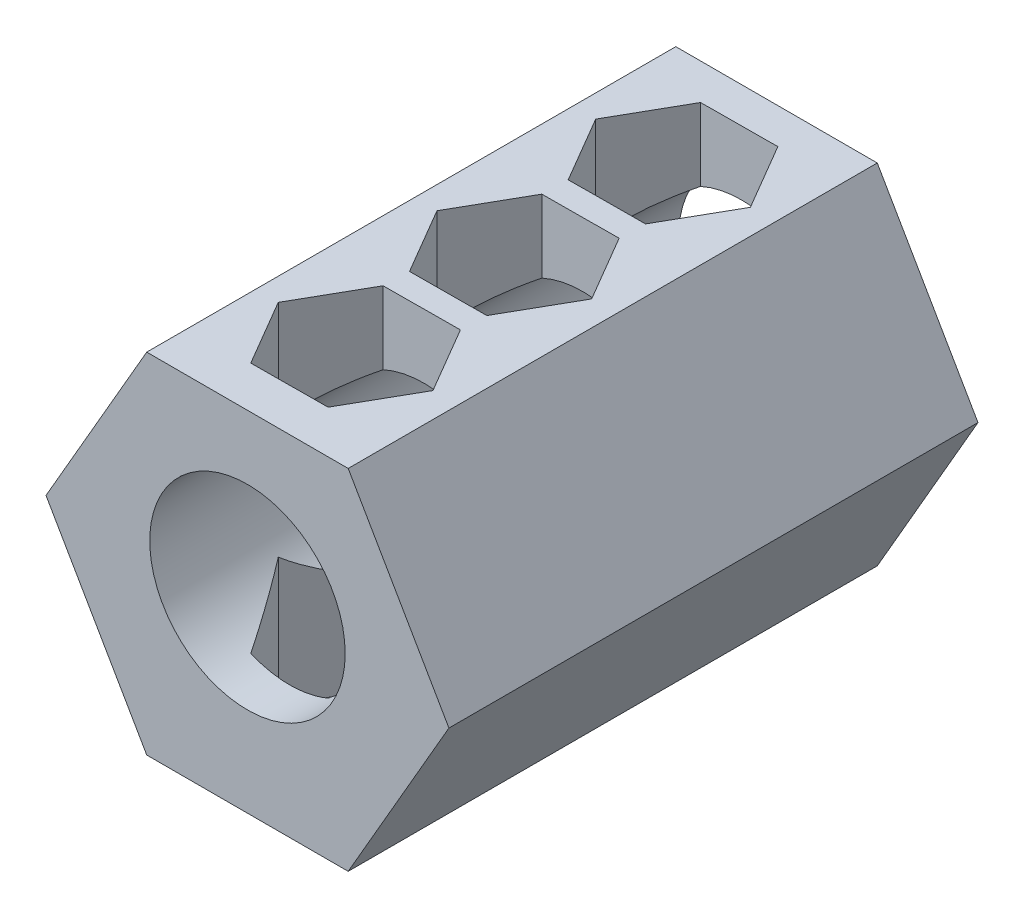
from build123d import *

# Parameters (mm, degrees)
EXTRUDE_1_DEPTH     = 100
SKETCH_2_R          = 18.469515879
CUT_EXTRUDE_1_DEPTH = 100
CUT_EXTRUDE_6_DEPTH = 126.697486666


with BuildPart() as part:
    # 草图1 → 凸台-拉伸1 (new body)
    with BuildSketch(Plane.XY):
        Polygon((38.078399894, 0), (19.039199947, 32.976861644), (-19.039199947, 32.976861644), (-38.078399894, 0), (-19.039199947, -32.976861644), (19.039199947, -32.976861644), align=None)
    extrude(amount=EXTRUDE_1_DEPTH)

    # 草图2 → 切除-拉伸1 (cut)
    with BuildSketch(Plane.XY.offset(100)):
        with Locations((0, 2.389391374)):
            Circle(SKETCH_2_R)
    extrude(amount=-CUT_EXTRUDE_1_DEPTH, mode=Mode.SUBTRACT)

    # 草图7 → 切除-拉伸6 (cut, through all)
    with BuildSketch(Plane(origin=(0, 32.976861644, 0), x_dir=(1, 0, 0), z_dir=(0, 1, 0))):
        Polygon((6.96455573, -36.71488632), (-7.562692597, -36.803663943), (-14.749433085, -49.429018853), (-7.408925244, -61.965596141), (7.118323083, -61.876818518), (14.305063571, -49.251463608), align=None)
        Polygon((6.96455573, -6.71488632), (-7.562692597, -6.803663943), (-14.749433085, -19.429018853), (-7.408925244, -31.965596141), (7.118323083, -31.876818518), (14.305063571, -19.251463608), align=None)
        Polygon((6.96455573, -66.71488632), (-7.562692597, -66.803663943), (-14.749433085, -79.429018853), (-7.408925244, -91.965596141), (7.118323083, -91.876818518), (14.305063571, -79.251463608), align=None)
    extrude(amount=-CUT_EXTRUDE_6_DEPTH, mode=Mode.SUBTRACT)


solid = part.part
